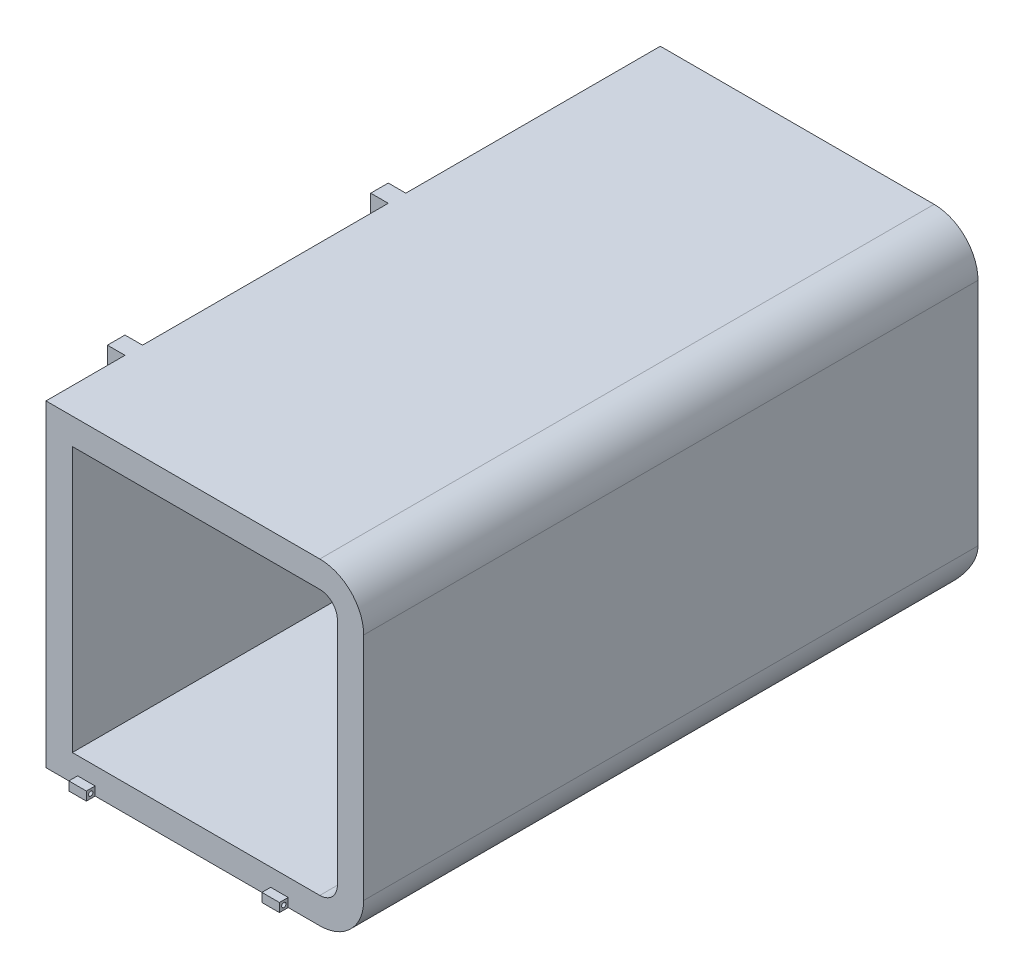
from build123d import *

# Parameters (mm, degrees)
BOSS_EXTRUDE1_DEPTH       = 35
BOSS_EXTRUDE3_DEPTH       = 1.5
SKETCH5_W                 = 1
SKETCH5_H                 = 1
BOSS_EXTRUDE4_DEPTH       = 18.1
CUT_EXTRUDE2_DEPTH        = 18.1
SKETCH9_W                 = 1
SKETCH9_H                 = 0.5
BOSS_EXTRUDE5_DEPTH       = 0.5
CUT_EXTRUDE3_REACH        = 41.512
SKETCH10_R                = 0.125
SKETCH11_R                = 2.5
BOSS_EXTRUDE6_DEPTH       = 1.5
SKETCH23_R                = 0.5
CUT_EXTRUDE12_DEPTH       = 1.5
SKETCH26_W                = 6.749879612
SKETCH26_H                = 8.598416767
SKETCH26_W_2              = 5.749879612
SKETCH26_H_2              = 7.598416767
BOSS_EXTRUDE16_DEPTH      = 2.05
BOSS_EXTRUDE23_REACH      = 41.419
BOSS_EXTRUDE23_END_RADIUS = 2.5
SKETCH27_W                = 0.594319842
SKETCH27_H                = 0.457567035
SKETCH27_R                = 0.154135996
SKETCH28_W                = 6.749879612
SKETCH28_H                = 8.598416767
BOSS_EXTRUDE24_DEPTH      = 0.5
SKETCH29_R                = 0.154135996
CUT_EXTRUDE13_DEPTH       = 2.5
SKETCH30_R                = 1.735676045
CUT_EXTRUDE14_DEPTH       = 0.5


with BuildPart() as part:
    # Sketch1 → Boss-Extrude1 (new body)
    with BuildSketch(Plane.XY):
        with BuildLine():
            Line((10.3, 6.55), (10.3, -6.55))
            ThreePointArc((10.3, -6.55), (9.567766953, -8.317766953), (7.8, -9.05))
            Line((7.8, -9.05), (-7.8, -9.05))
            Line((-7.8, -9.05), (-7.8, 9.05))
            Line((-7.8, 9.05), (7.8, 9.05))
            ThreePointArc((7.8, 9.05), (9.567766953, 8.317766953), (10.3, 6.55))
        make_face()
        with BuildLine():
            Line((-6.3, 7.55), (7.8, 7.55))
            ThreePointArc((7.8, 7.55), (8.507106781, 7.257106781), (8.8, 6.55))
            Line((8.8, 6.55), (8.8, -6.55))
            ThreePointArc((8.8, -6.55), (8.507106781, -7.257106781), (7.8, -7.55))
            Line((7.8, -7.55), (-6.3, -7.55))
            Line((-6.3, -7.55), (-6.3, 7.55))
        make_face(mode=Mode.SUBTRACT)
    extrude(amount=BOSS_EXTRUDE1_DEPTH)

    # Sketch4 → Boss-Extrude3 (add)
    with BuildSketch(Plane(origin=(0, 0, 0), x_dir=(-1, 0, 0), z_dir=(0, 0, -1))):
        with BuildLine():
            Line((7.8, -9.05), (7.8, 9.05))
            Line((7.8, 9.05), (-7.8, 9.05))
            ThreePointArc((-7.8, 9.05), (-9.567766953, 8.317766953), (-10.3, 6.55))
            Line((-10.3, 6.55), (-10.3, -6.55))
            ThreePointArc((-10.3, -6.55), (-9.567766953, -8.317766953), (-7.8, -9.05))
            Line((-7.8, -9.05), (7.8, -9.05))
        make_face()
    extrude(amount=-BOSS_EXTRUDE3_DEPTH)

    # Sketch5 → Boss-Extrude4 (add)
    with BuildSketch(Plane.XZ.offset(9.05)):
        with Locations((-8.3, 15)):
            Rectangle(SKETCH5_W, SKETCH5_H)
        with Locations((-8.3, 30)):
            Rectangle(SKETCH5_W, SKETCH5_H)
    extrude(amount=-BOSS_EXTRUDE4_DEPTH)

    # Sketch8 → Cut-Extrude2 (cut)
    with BuildSketch(Plane.ZY.offset(7.8)):
        with BuildLine():
            Line((0, -6.55), (0, -9.05))
            Line((0, -9.05), (2.5, -9.05))
            ThreePointArc((2.5, -9.05), (0.732233047, -8.317766953), (0, -6.55))
        make_face()
    extrude(amount=-CUT_EXTRUDE2_DEPTH, mode=Mode.SUBTRACT)

    # Sketch9 → Boss-Extrude5 (add)
    with BuildSketch(Plane.XY.offset(35)):
        with Locations((-5.5, -8.8)):
            Rectangle(SKETCH9_W, SKETCH9_H)
        with Locations((5.5, -8.8)):
            Rectangle(SKETCH9_W, SKETCH9_H)
    extrude(amount=BOSS_EXTRUDE5_DEPTH)

    # Cut-Extrude3: up to this face of the body (flat: up to its plane)
    cut_extrude3_end = Plane(part.part.faces().sort_by_distance((-6, -8.8, 35.25))[0])
    # Sketch10 → Cut-Extrude3 (cut, up to the picked face)
    with BuildSketch(Plane(origin=(6, 0, 0), x_dir=(0, 0, -1), z_dir=(1, 0, 0)), mode=Mode.PRIVATE) as cut_extrude3_sk1:
        with Locations((-35.25, -8.8)):
            Circle(SKETCH10_R)
    cut_extrude3_tool1 = split(extrude(cut_extrude3_sk1.sketch, amount=-CUT_EXTRUDE3_REACH, mode=Mode.PRIVATE), bisect_by=cut_extrude3_end, keep=Keep.BOTH, mode=Mode.PRIVATE)
    add(cut_extrude3_tool1.solids().sort_by(Axis((6, -8.8, 35.25), (-1, 0, 0)))[0], mode=Mode.SUBTRACT)

    # Sketch11 → Boss-Extrude6 (add)
    with BuildSketch(Plane.XY.offset(1.5)):
        with Locations(Location((0, 0, 0), (0, 0, 180))):
            Circle(SKETCH11_R)
    extrude(amount=BOSS_EXTRUDE6_DEPTH)

    # Sketch23 → Cut-Extrude12 (cut)
    with BuildSketch(Plane.ZY.offset(7.8)):
        with Locations(Location((6.47352849, -4.947355043, 0), (0, 0, 270))):
            Circle(SKETCH23_R)
    extrude(amount=-CUT_EXTRUDE12_DEPTH, mode=Mode.SUBTRACT)

    # Sketch26 → Boss-Extrude16 (add)
    with BuildSketch(Plane(origin=(-6.3, 0, 0), x_dir=(0, 0, -1), z_dir=(1, 0, 0))):
        with Locations((-4.874939806, -3.250791617)):
            Rectangle(SKETCH26_W, SKETCH26_H)
        with Locations((-4.874939806, -3.250791617)):
            Rectangle(SKETCH26_W_2, SKETCH26_H_2, mode=Mode.SUBTRACT)
    extrude(amount=BOSS_EXTRUDE16_DEPTH)

    # Boss-Extrude23: up to this cylinder (the profile starts outside it)
    boss_extrude23_end = Plane(origin=(0, 0, 2.254205), z_dir=(0, 0, -1)) * Cylinder(BOSS_EXTRUDE23_END_RADIUS, 88.838, mode=Mode.PRIVATE)
    # Sketch27 → Boss-Extrude23 (add, up to the surface)
    with BuildSketch(Plane(origin=(-4.25, 0, 0), x_dir=(0, 0, -1), z_dir=(1, 0, 0)), mode=Mode.PRIVATE) as boss_extrude23_sk1:
        with Locations((-2.25420487, 0.344193495)):
            Rectangle(SKETCH27_W, SKETCH27_H)
        with Locations(Location((-2.239067338, 0.317165037, 0), (0, 0, 270))):
            Circle(SKETCH27_R, mode=Mode.SUBTRACT)
    boss_extrude23_tool1 = extrude(boss_extrude23_sk1.sketch, amount=BOSS_EXTRUDE23_REACH, mode=Mode.PRIVATE) - boss_extrude23_end
    add(boss_extrude23_tool1.solids().sort_by_distance((-4.25, 0.565476, 2.254205))[0])

    # Sketch28 → Boss-Extrude24 (add)
    with BuildSketch(Plane(origin=(-4.25, 0, 0), x_dir=(0, 0, -1), z_dir=(1, 0, 0))):
        with Locations((-4.874939806, -3.250791617)):
            Rectangle(SKETCH28_W, SKETCH28_H)
    extrude(amount=BOSS_EXTRUDE24_DEPTH)

    # Sketch29 → Cut-Extrude13 (cut)
    with BuildSketch(Plane.ZY.offset(4.25)):
        with Locations((2.239067338, 0.317165037)):
            Circle(SKETCH29_R)
    extrude(amount=-CUT_EXTRUDE13_DEPTH, mode=Mode.SUBTRACT)

    # Sketch30 → Cut-Extrude14 (cut)
    with BuildSketch(Plane.XY.offset(3)):
        Circle(SKETCH30_R)
    extrude(amount=-CUT_EXTRUDE14_DEPTH, mode=Mode.SUBTRACT)


solid = part.part
